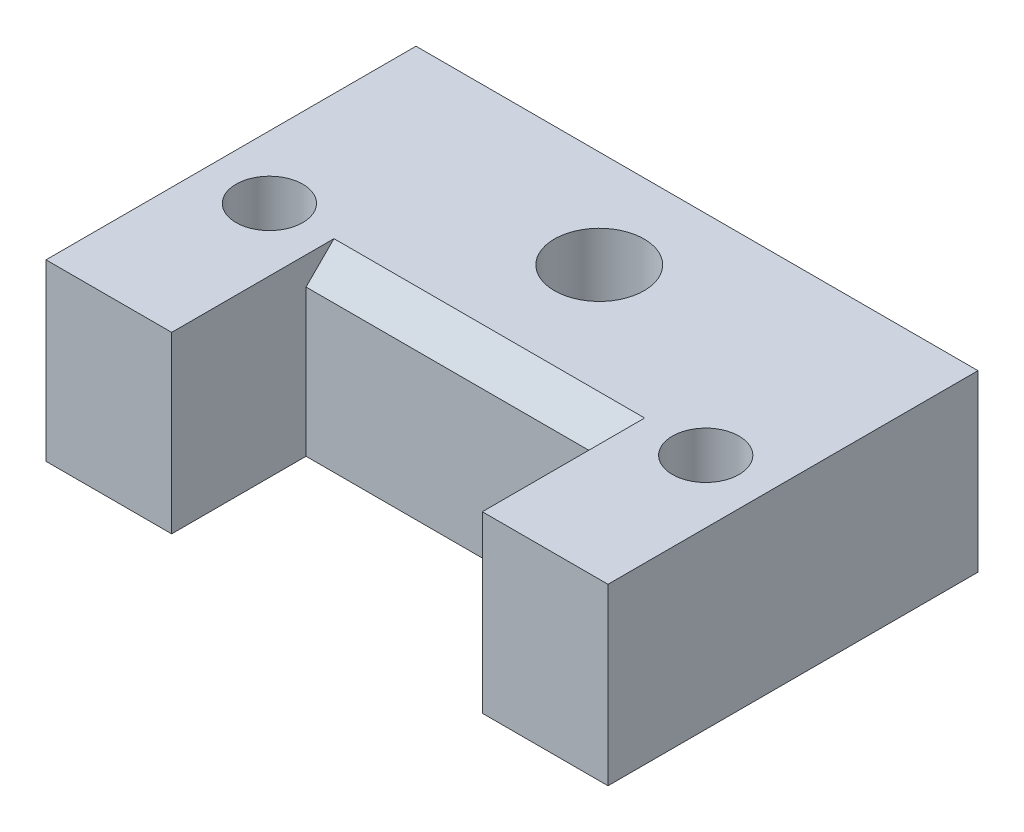
from build123d import *

# Parameters (mm, degrees)
CROQUIS2_W                 = 40.894
CROQUIS2_H                 = 26.924
SALIENTE_EXTRUIR1_DEPTH    = 12.7
CROQUIS3_W                 = 22.606
CROQUIS3_H                 = 9.779
CORTAR_EXTRUIR1_DEPTH      = 12.7
CROQUIS6_R                 = 2.4257
CORTAR_EXTRUIR2_DEPTH      = 12.7
TALADRO_ROSCADO_5_16_181_D = 6.5278
CHAFL_N1_SIZE              = 2.032


with BuildPart() as part:
    # Croquis2 → Saliente-Extruir1 (new body)
    with BuildSketch(Plane(origin=(0, 0, 0), x_dir=(1, 0, 0), z_dir=(0, 1, 0))):
        Rectangle(CROQUIS2_W, CROQUIS2_H)
    extrude(amount=SALIENTE_EXTRUIR1_DEPTH)

    # Croquis3 → Cortar-Extruir1 (cut)
    with BuildSketch(Plane(origin=(0, 12.7, 0), x_dir=(1, 0, 0), z_dir=(0, 1, 0))):
        with Locations((0, -8.5725)):
            Rectangle(CROQUIS3_W, CROQUIS3_H)
    extrude(amount=-CORTAR_EXTRUIR1_DEPTH, mode=Mode.SUBTRACT)

    # Croquis6 → Cortar-Extruir2 (cut)
    with BuildSketch(Plane(origin=(0, 12.7, 0), x_dir=(1, 0, 0), z_dir=(0, 1, 0))):
        with Locations(Location((-15.875, -1.778, 0), (0, 0, 270))):
            Circle(CROQUIS6_R)
        with Locations(Location((15.875, -1.778, 0), (0, 0, 270))):
            Circle(CROQUIS6_R)
    extrude(amount=-CORTAR_EXTRUIR2_DEPTH, mode=Mode.SUBTRACT)

    # Taladro roscado 5/16-181 (through all)
    with Locations(Plane(origin=(0, 12.7, 0), x_dir=(1, 0, 0), z_dir=(0, 1, 0))):
        with Locations((0, 6.35)):
            Hole(TALADRO_ROSCADO_5_16_181_D / 2)

    # Chaflán1
    chafl_n1_edges = [part.edges().sort_by_distance(p)[0] for p in [
        (0, 12.7, 3.683),
    ]]
    chamfer(chafl_n1_edges, length=CHAFL_N1_SIZE)


solid = part.part
